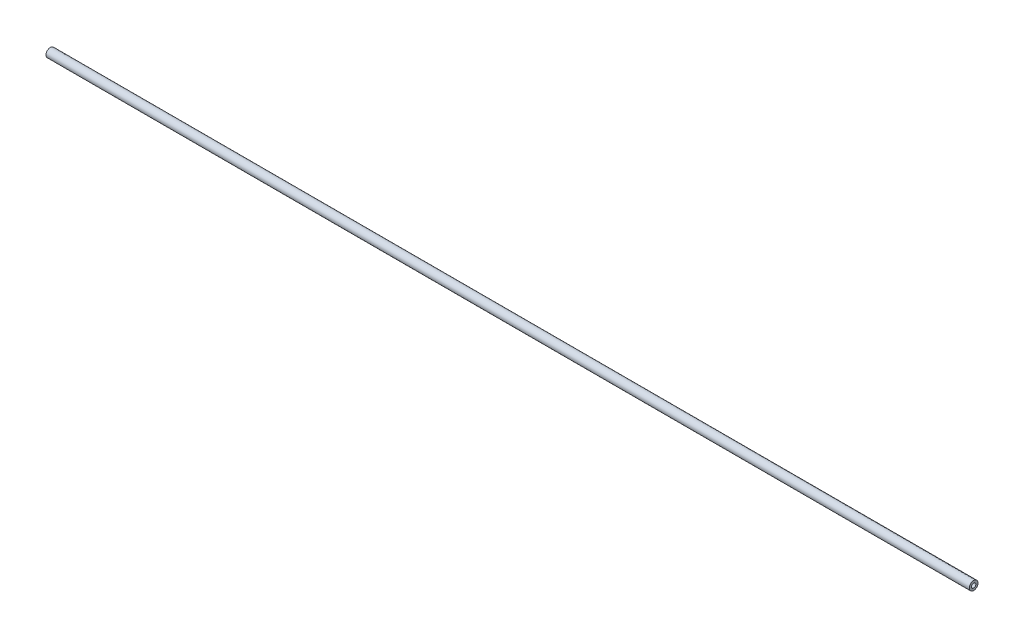
from build123d import *

# Parameters (mm, degrees)
SKETCH1_R           = 3
SKETCH1_R_2         = 1.5
BOSS_EXTRUDE1_DEPTH = 317.5


with BuildPart() as part:
    # Sketch1 → Boss-Extrude1 (new, symmetric)
    with BuildSketch(Plane(origin=(0, 0, 0), x_dir=(0, 0, -1), z_dir=(1, 0, 0))):
        with Locations(Location((0, 0, 0), (0, 0, 180))):
            Circle(SKETCH1_R)
        with Locations(Location((0, 0, 0), (0, 0, 180))):
            Circle(SKETCH1_R_2, mode=Mode.SUBTRACT)
    extrude(amount=BOSS_EXTRUDE1_DEPTH, both=True)


solid = part.part
